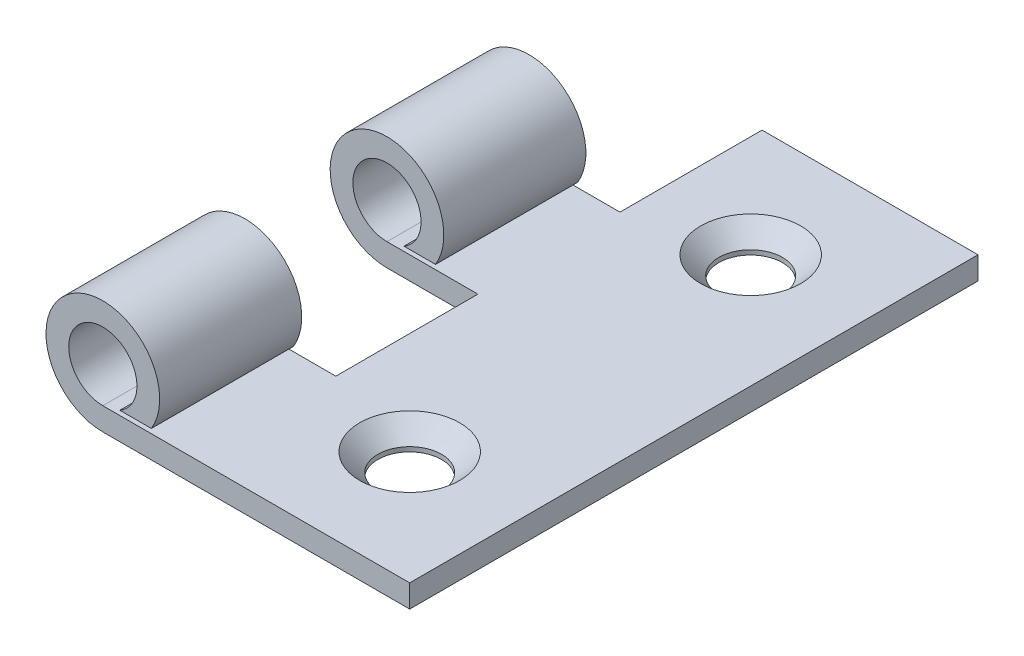
from build123d import *

# Parameters (mm, degrees)
EXTRUDE_1_DEPTH          = 25
CUT_EXTRUDE_1_DEPTH      = 25
CUT_EXTRUDE_1_DEPTH_BACK = 25
SKETCH_2_R               = 1.4
SKETCH_2_W               = 8.931793576
SKETCH_2_H               = 6.25
SKETCH_2_H_2             = 7.571808546
CHAMFER_1_SIZE           = 0.8


with BuildPart() as part:
    # Эскиз1 → Вытянуть1 (new body)
    with BuildSketch(Plane.XY):
        with BuildLine():
            Line((0, 0), (13.5, 0))
            Line((13.5, 0), (13.5, 1))
            Line((13.5, 1), (0, 1))
            ThreePointArc((0, 1), (-0.387298335, 3.949137675), (0.748331477, 1.2))
            Line((0.748331477, 1.2), (2.13541565, 1.2))
            ThreePointArc((2.13541565, 1.2), (-1.224744871, 4.679449472), (0, 0))
        make_face()
    extrude(amount=EXTRUDE_1_DEPTH)

    # Эскиз2 → Вырез-Вытянуть1 (cut, two sides: drawn at the far end of the back side and taken through both)
    with BuildSketch(Plane(origin=(0, 1, 0), x_dir=(-1, 0, 0), z_dir=(0, 1, 0)).offset(-CUT_EXTRUDE_1_DEPTH_BACK)):
        with Locations((-8.5, 20)):
            Circle(SKETCH_2_R)
        with Locations((-8.5, 5)):
            Circle(SKETCH_2_R)
        with Locations((0.465896788, 15.625)):
            Rectangle(SKETCH_2_W, SKETCH_2_H)
        with Locations((0.465896788, 2.464095727)):
            Rectangle(SKETCH_2_W, SKETCH_2_H_2)
    extrude(amount=CUT_EXTRUDE_1_DEPTH + CUT_EXTRUDE_1_DEPTH_BACK, mode=Mode.SUBTRACT)

    # Фаска1
    chamfer_1_edges = [part.edges().sort_by_distance(p)[0] for p in [
        (9.9, 1, 20),
        (9.9, 1, 5),
    ]]
    chamfer(chamfer_1_edges, length=CHAMFER_1_SIZE)


solid = part.part
